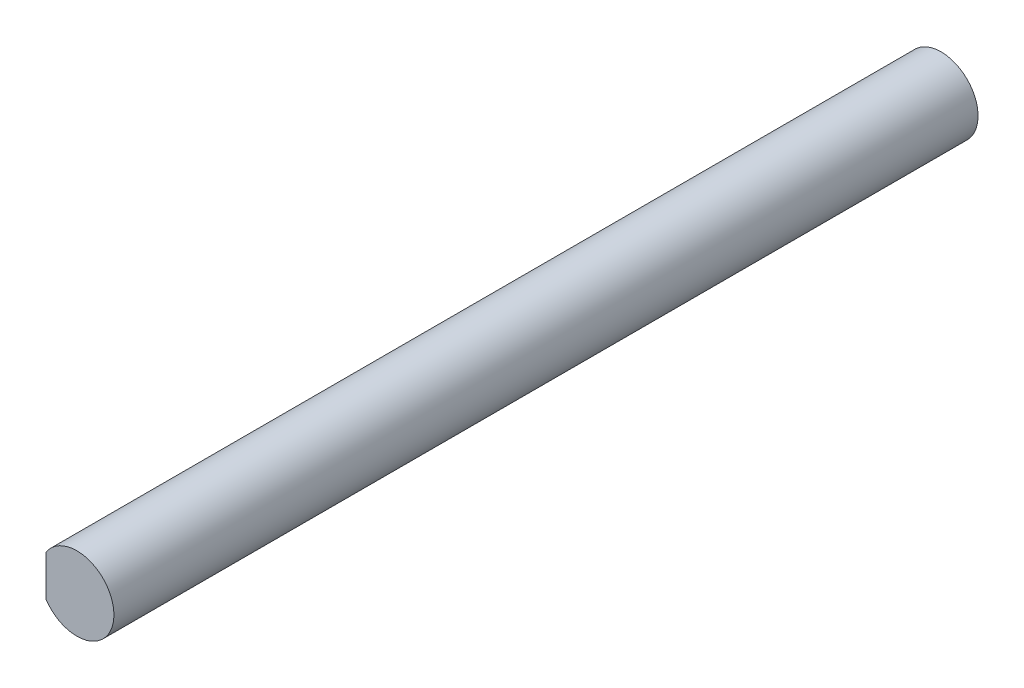
from build123d import *

# Parameters (mm, degrees)
BOSS_EXTRUDE1_DEPTH = 70


with BuildPart() as part:
    # Sketch1 → Boss-Extrude1 (new body)
    with BuildSketch(Plane.XY):
        with BuildLine():
            Line((-2.5, 1.658312395), (-2.5, -1.658312395))
            ThreePointArc((-2.5, -1.658312395), (3, 0), (-2.5, 1.658312395))
        make_face()
    extrude(amount=BOSS_EXTRUDE1_DEPTH)


solid = part.part
